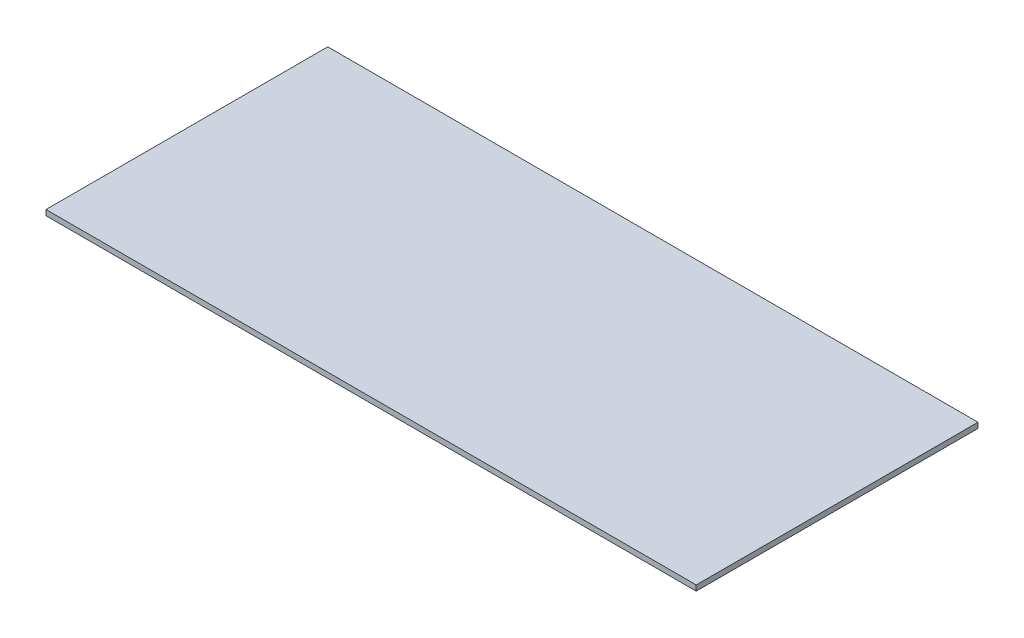
from build123d import *

# Parameters (mm, degrees)
SKETCH1_W           = 381
SKETCH1_H           = 165.1
BOSS_EXTRUDE1_DEPTH = 3.175


with BuildPart() as part:
    # Sketch1 → Boss-Extrude1 (new body)
    with BuildSketch(Plane(origin=(0, 0, 0), x_dir=(1, 0, 0), z_dir=(0, 1, 0))):
        Rectangle(SKETCH1_W, SKETCH1_H)
    extrude(amount=BOSS_EXTRUDE1_DEPTH)


solid = part.part
